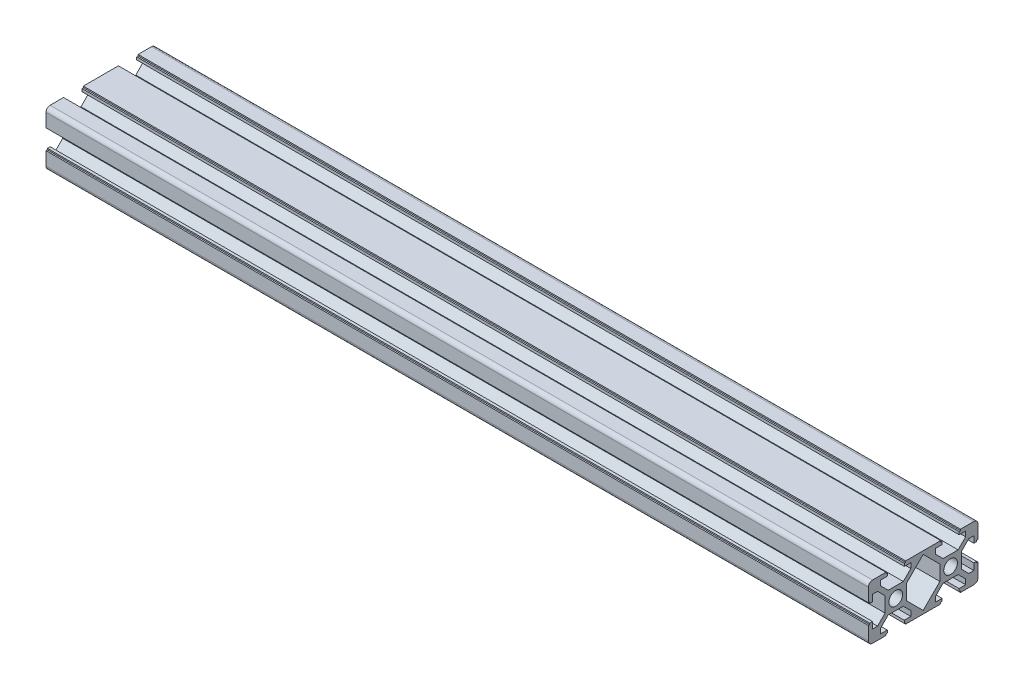
from build123d import *

# Parameters (mm, degrees)
SKETCH16_R           = 2.5
F_20X40XR1_5_2_DEPTH = 300


with BuildPart() as part:
    # Sketch16 → 铝型材 20X40XR1.5(2) (new body)
    with BuildSketch(Plane(origin=(-53.342500755, -1.452155193, 0), x_dir=(0, 1, 0), z_dir=(1, 0, 0))):
        with BuildLine():
            Line((-3.6, 10), (-3.6, 9.5))
            Line((-3.6, 9.5), (-3.1, 9.5))
            Line((-3.1, 9.5), (-3.1, 8.5))
            Line((-3.1, 8.5), (-5.5, 8.5))
            Line((-5.5, 8.5), (-5.5, 6.65))
            Line((-5.5, 6.65), (-2.75, 3.9))
            Line((-2.75, 3.9), (2.75, 3.9))
            Line((2.75, 3.9), (5.5, 6.65))
            Line((5.5, 6.65), (5.5, 8.5))
            Line((5.5, 8.5), (3.1, 8.5))
            Line((3.1, 8.5), (3.1, 9.5))
            Line((3.1, 9.5), (3.6, 9.5))
            Line((3.6, 9.5), (3.6, 10))
            Line((3.6, 10), (8.5, 10))
            ThreePointArc((8.5, 10), (9.560660172, 9.560660172), (10, 8.5))
            Line((10, 8.5), (10, 3.6))
            Line((10, 3.6), (9.5, 3.6))
            Line((9.5, 3.6), (9.5, 3.1))
            Line((9.5, 3.1), (8.5, 3.1))
            Line((8.5, 3.1), (8.5, 5.5))
            Line((8.5, 5.5), (6.65, 5.5))
            Line((6.65, 5.5), (3.9, 2.75))
            Line((3.9, 2.75), (3.9, -2.75))
            Line((3.9, -2.75), (6.65, -5.5))
            Line((6.65, -5.5), (8.5, -5.5))
            Line((8.5, -5.5), (8.5, -3.1))
            Line((8.5, -3.1), (9.5, -3.1))
            Line((9.5, -3.1), (9.5, -3.6))
            Line((9.5, -3.6), (10, -3.6))
            Line((10, -3.6), (10, -16.4))
            Line((10, -16.4), (9.5, -16.4))
            Line((9.5, -16.4), (9.5, -16.9))
            Line((9.5, -16.9), (8.5, -16.9))
            Line((8.5, -16.9), (8.5, -14.5))
            Line((8.5, -14.5), (6.65, -14.5))
            Line((6.65, -14.5), (3.9, -17.25))
            Line((3.9, -17.25), (3.9, -22.75))
            Line((3.9, -22.75), (6.65, -25.5))
            Line((6.65, -25.5), (8.5, -25.5))
            Line((8.5, -25.5), (8.5, -23.1))
            Line((8.5, -23.1), (9.5, -23.1))
            Line((9.5, -23.1), (9.5, -23.6))
            Line((9.5, -23.6), (10, -23.6))
            Line((10, -23.6), (10, -28.5))
            ThreePointArc((10, -28.5), (9.560660172, -29.560660172), (8.5, -30))
            Line((8.5, -30), (3.6, -30))
            Line((3.6, -30), (3.6, -29.5))
            Line((3.6, -29.5), (3.1, -29.5))
            Line((3.1, -29.5), (3.1, -28.5))
            Line((3.1, -28.5), (5.5, -28.5))
            Line((5.5, -28.5), (5.5, -26.65))
            Line((5.5, -26.65), (2.75, -23.9))
            Line((2.75, -23.9), (-2.75, -23.9))
            Line((-2.75, -23.9), (-5.5, -26.65))
            Line((-5.5, -26.65), (-5.5, -28.5))
            Line((-5.5, -28.5), (-3.1, -28.5))
            Line((-3.1, -28.5), (-3.1, -29.5))
            Line((-3.1, -29.5), (-3.6, -29.5))
            Line((-3.6, -29.5), (-3.6, -30))
            Line((-3.6, -30), (-8.5, -30))
            ThreePointArc((-8.5, -30), (-9.560660172, -29.560660172), (-10, -28.5))
            Line((-10, -28.5), (-10, -23.6))
            Line((-10, -23.6), (-9.5, -23.6))
            Line((-9.5, -23.6), (-9.5, -23.1))
            Line((-9.5, -23.1), (-8.5, -23.1))
            Line((-8.5, -23.1), (-8.5, -25.5))
            Line((-8.5, -25.5), (-6.65, -25.5))
            Line((-6.65, -25.5), (-3.9, -22.75))
            Line((-3.9, -22.75), (-3.9, -17.25))
            Line((-3.9, -17.25), (-6.65, -14.5))
            Line((-6.65, -14.5), (-8.5, -14.5))
            Line((-8.5, -14.5), (-8.5, -16.9))
            Line((-8.5, -16.9), (-9.5, -16.9))
            Line((-9.5, -16.9), (-9.5, -16.4))
            Line((-9.5, -16.4), (-10, -16.4))
            Line((-10, -16.4), (-10, -3.6))
            Line((-10, -3.6), (-9.5, -3.6))
            Line((-9.5, -3.6), (-9.5, -3.1))
            Line((-9.5, -3.1), (-8.5, -3.1))
            Line((-8.5, -3.1), (-8.5, -5.5))
            Line((-8.5, -5.5), (-6.65, -5.5))
            Line((-6.65, -5.5), (-3.9, -2.75))
            Line((-3.9, -2.75), (-3.9, 2.75))
            Line((-3.9, 2.75), (-6.65, 5.5))
            Line((-6.65, 5.5), (-8.5, 5.5))
            Line((-8.5, 5.5), (-8.5, 3.1))
            Line((-8.5, 3.1), (-9.5, 3.1))
            Line((-9.5, 3.1), (-9.5, 3.6))
            Line((-9.5, 3.6), (-10, 3.6))
            Line((-10, 3.6), (-10, 8.5))
            ThreePointArc((-10, 8.5), (-9.560660172, 9.560660172), (-8.5, 10))
            Line((-8.5, 10), (-3.6, 10))
        make_face()
        Circle(SKETCH16_R, mode=Mode.SUBTRACT)
        with Locations((0, -20)):
            Circle(SKETCH16_R, mode=Mode.SUBTRACT)
        Polygon((8.85, -10), (2.75, -3.9), (-2.75, -3.9), (-8.85, -10), (-2.75, -16.1), (2.75, -16.1), align=None, mode=Mode.SUBTRACT)
    extrude(amount=F_20X40XR1_5_2_DEPTH)


solid = part.part
